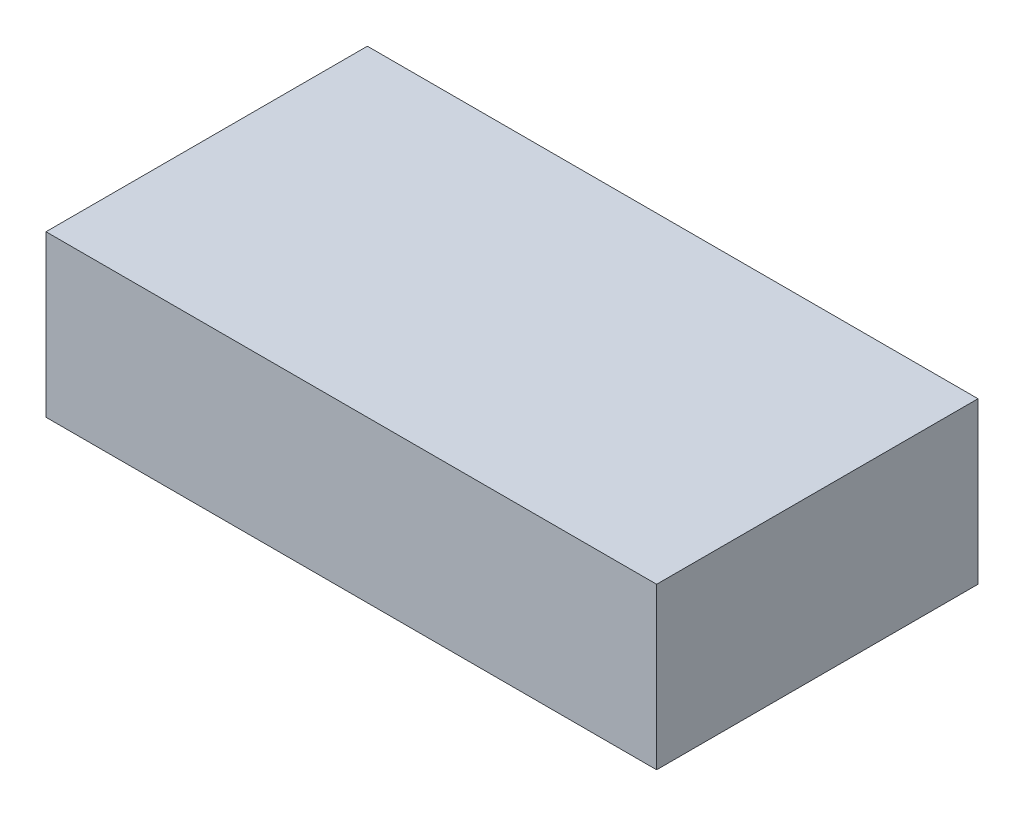
from build123d import *

# Parameters (mm, degrees)
SKETCH1_W           = 76
SKETCH1_H           = 40
BOSS_EXTRUDE1_DEPTH = 20


with BuildPart() as part:
    # Sketch1 → Boss-Extrude1 (new body)
    with BuildSketch(Plane(origin=(0, 0, 0), x_dir=(1, 0, 0), z_dir=(0, 1, 0))):
        with Locations((65.514202899, 38.751304348)):
            Rectangle(SKETCH1_W, SKETCH1_H)
    extrude(amount=BOSS_EXTRUDE1_DEPTH)


solid = part.part
